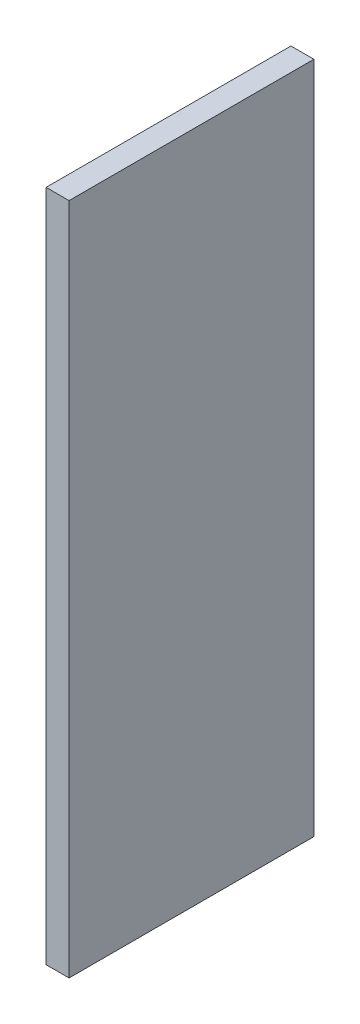
from build123d import *

# Parameters (mm, degrees)
SKETCH1_W           = 203.2
SKETCH1_H           = 558.8
BOSS_EXTRUDE1_DEPTH = 19.05


with BuildPart() as part:
    # Sketch1 → Boss-Extrude1 (new body)
    with BuildSketch(Plane(origin=(0, 0, 0), x_dir=(0, 0, -1), z_dir=(1, 0, 0))):
        with Locations((71.133366082, 231.419612452)):
            Rectangle(SKETCH1_W, SKETCH1_H)
    extrude(amount=BOSS_EXTRUDE1_DEPTH)


solid = part.part
